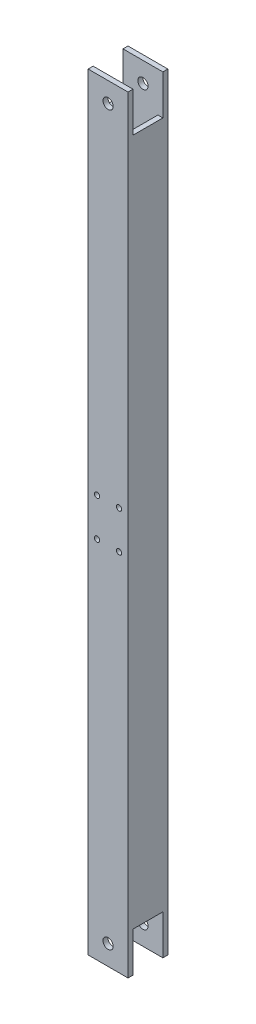
from build123d import *

# Parameters (mm, degrees)
SKETCH1_W           = 25.4
SKETCH1_H           = 25.4
SKETCH1_W_2         = 19.05
SKETCH1_H_2         = 19.05
BOSS_EXTRUDE1_DEPTH = 488.95
CUT_EXTRUDE1_REACH  = 492.268
SKETCH2_R           = 1.7
SKETCH5_W           = 19.05
SKETCH5_H           = 25.400569513
CUT_EXTRUDE2_DEPTH  = 491.267704933
CUT_EXTRUDE3_REACH  = 492.268
SKETCH6_R           = 3.2639


with BuildPart() as part:
    # Sketch1 → Boss-Extrude1 (new body)
    with BuildSketch(Plane(origin=(0, 0, 0), x_dir=(1, 0, 0), z_dir=(0, 1, 0))):
        with Locations((12.7, -12.7)):
            Rectangle(SKETCH1_W, SKETCH1_H)
        with Locations((12.7, -12.7)):
            Rectangle(SKETCH1_W_2, SKETCH1_H_2, mode=Mode.SUBTRACT)
    extrude(amount=BOSS_EXTRUDE1_DEPTH)

    # Cut-Extrude1: up to this face of the body (flat: up to its plane)
    cut_extrude1_end = Plane(part.part.faces().sort_by_distance((12.7, 244.475, 25.4))[0])
    # Sketch2 → Cut-Extrude1 (cut, up to the picked face)
    with BuildSketch(Plane(origin=(0, 0, 0), x_dir=(-1, 0, 0), z_dir=(0, 0, -1)), mode=Mode.PRIVATE) as cut_extrude1_sk1:
        with Locations((-5.7, 232.350644347)):
            Circle(SKETCH2_R)
    cut_extrude1_tool1 = split(extrude(cut_extrude1_sk1.sketch, amount=-CUT_EXTRUDE1_REACH, mode=Mode.PRIVATE), bisect_by=cut_extrude1_end, keep=Keep.BOTH, mode=Mode.PRIVATE)
    # Sketch2 → Cut-Extrude1 (cut, up to the picked face)
    with BuildSketch(Plane(origin=(0, 0, 0), x_dir=(-1, 0, 0), z_dir=(0, 0, -1)), mode=Mode.PRIVATE) as cut_extrude1_sk2:
        with Locations((-19.7, 232.350644347)):
            Circle(SKETCH2_R)
    cut_extrude1_tool2 = split(extrude(cut_extrude1_sk2.sketch, amount=-CUT_EXTRUDE1_REACH, mode=Mode.PRIVATE), bisect_by=cut_extrude1_end, keep=Keep.BOTH, mode=Mode.PRIVATE)
    # Sketch2 → Cut-Extrude1 (cut, up to the picked face)
    with BuildSketch(Plane(origin=(0, 0, 0), x_dir=(-1, 0, 0), z_dir=(0, 0, -1)), mode=Mode.PRIVATE) as cut_extrude1_sk3:
        with Locations((-19.7, 256.599355653)):
            Circle(SKETCH2_R)
    cut_extrude1_tool3 = split(extrude(cut_extrude1_sk3.sketch, amount=-CUT_EXTRUDE1_REACH, mode=Mode.PRIVATE), bisect_by=cut_extrude1_end, keep=Keep.BOTH, mode=Mode.PRIVATE)
    # Sketch2 → Cut-Extrude1 (cut, up to the picked face)
    with BuildSketch(Plane(origin=(0, 0, 0), x_dir=(-1, 0, 0), z_dir=(0, 0, -1)), mode=Mode.PRIVATE) as cut_extrude1_sk4:
        with Locations((-5.7, 256.599355653)):
            Circle(SKETCH2_R)
    cut_extrude1_tool4 = split(extrude(cut_extrude1_sk4.sketch, amount=-CUT_EXTRUDE1_REACH, mode=Mode.PRIVATE), bisect_by=cut_extrude1_end, keep=Keep.BOTH, mode=Mode.PRIVATE)
    add(cut_extrude1_tool1.solids().sort_by(Axis((5.7, 232.350644, 0), (0, 0, 1)))[0], mode=Mode.SUBTRACT)
    add(cut_extrude1_tool2.solids().sort_by(Axis((19.7, 232.350644, 0), (0, 0, 1)))[0], mode=Mode.SUBTRACT)
    add(cut_extrude1_tool3.solids().sort_by(Axis((19.7, 256.599356, 0), (0, 0, 1)))[0], mode=Mode.SUBTRACT)
    add(cut_extrude1_tool4.solids().sort_by(Axis((5.7, 256.599356, 0), (0, 0, 1)))[0], mode=Mode.SUBTRACT)

    # Sketch5 → Cut-Extrude2 (cut, through all)
    with BuildSketch(Plane.ZY):
        with Locations((12.7, 12.700284757)):
            Rectangle(SKETCH5_W, SKETCH5_H)
    cut_extrude2 = extrude(amount=-CUT_EXTRUDE2_DEPTH, mode=Mode.SUBTRACT)

    # Mirror1: Cut-Extrude2 across plane
    add(cut_extrude2.mirror(Plane.ZX.offset(244.475)), mode=Mode.SUBTRACT)

    # Cut-Extrude3: up to this face of the body (flat: up to its plane)
    cut_extrude3_end = Plane(part.part.faces().sort_by_distance((12.7, 244.475, 0))[0])
    # Sketch6 → Cut-Extrude3 (cut, up to the picked face)
    with BuildSketch(Plane.XY.offset(25.4), mode=Mode.PRIVATE) as cut_extrude3_sk1:
        with Locations((12.7, 12.7)):
            Circle(SKETCH6_R)
    cut_extrude3_tool1 = split(extrude(cut_extrude3_sk1.sketch, amount=-CUT_EXTRUDE3_REACH, mode=Mode.PRIVATE), bisect_by=cut_extrude3_end, keep=Keep.BOTH, mode=Mode.PRIVATE)
    cut_extrude3 = cut_extrude3_tool1.solids().sort_by(Axis((12.7, 12.7, 25.4), (0, 0, -1)))[0]
    add(cut_extrude3, mode=Mode.SUBTRACT)

    # Mirror2: Cut-Extrude3 across plane
    add(cut_extrude3.mirror(Plane.ZX.offset(244.475)), mode=Mode.SUBTRACT)


solid = part.part
